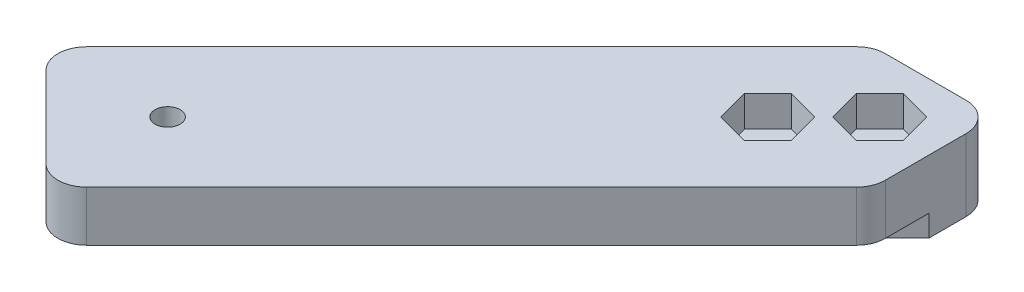
from build123d import *

# Parameters (mm, degrees)
SKETCH1_W           = 74.397474683
SKETCH1_H           = 76.437474683
SKETCH1_R           = 1.75
SKETCH1_R_2         = 2
BOSS_EXTRUDE1_DEPTH = 7
CUT_EXTRUDE1_DEPTH  = 4.3
CUT_EXTRUDE2_DEPTH  = 82.61445454
CUT_EXTRUDE3_DEPTH  = 3.2
BOSS_EXTRUDE2_START = 3
SKETCH5_R           = 2
BOSS_EXTRUDE2_DEPTH = 3
CUT_EXTRUDE4_DEPTH  = 82.926303407
FILLET1_R           = 4


with BuildPart() as part:
    # Sketch1 → Boss-Extrude1 (new body)
    with BuildSketch(Plane(origin=(0, 0, 0), x_dir=(1, 0, 0), z_dir=(0, 1, 0))):
        with Locations((20.298737342, 19.278737341)):
            Rectangle(SKETCH1_W, SKETCH1_H)
        with Locations(Location((0, 0, 0), (0, 0, 270))):
            Circle(SKETCH1_R, mode=Mode.SUBTRACT)
        with Locations(Location((49.497474683, 49.497474683, 0), (0, 0, 270))):
            Circle(SKETCH1_R_2, mode=Mode.SUBTRACT)
        with Locations(Location((41.71930009, 41.71930009, 0), (0, 0, 270))):
            Circle(SKETCH1_R_2, mode=Mode.SUBTRACT)
    extrude(amount=BOSS_EXTRUDE1_DEPTH)

    # Sketch2 → Cut-Extrude1 (cut)
    with BuildSketch(Plane(origin=(0, 7, 0), x_dir=(1, 0, 0), z_dir=(0, 1, 0))):
        Polygon((38.453313766, 38.453313766), (42.914734053, 37.257879803), (46.180720377, 40.523866127), (44.985286414, 44.985286414), (40.523866127, 46.180720377), (37.257879803, 42.914734053), align=None)
        Polygon((50.692908646, 45.036054396), (53.95889497, 48.30204072), (52.763461007, 52.763461007), (48.30204072, 53.95889497), (45.036054396, 50.692908646), (46.231488359, 46.231488359), align=None)
    extrude(amount=-CUT_EXTRUDE1_DEPTH, mode=Mode.SUBTRACT)

    # Sketch3 → Cut-Extrude2 (cut, through all)
    with BuildSketch(Plane(origin=(0, 7, 0), x_dir=(1, 0, 0), z_dir=(0, 1, 0))):
        Polygon((-16.9, 0), (2.04, -18.94), (-16.9, -18.94), align=None)
    extrude(amount=-CUT_EXTRUDE2_DEPTH, mode=Mode.SUBTRACT)

    # Sketch4 → Cut-Extrude3 (cut)
    with BuildSketch(Plane.XZ):
        Polygon((1.732050808, -3), (3.464101615, 0), (1.732050808, 3), (-1.732050808, 3), (-3.464101615, 0), (-1.732050808, -3), align=None)
    extrude(amount=-CUT_EXTRUDE3_DEPTH, mode=Mode.SUBTRACT)

    # Sketch5 → Boss-Extrude2 (add)
    with BuildSketch(Plane.XZ.offset(BOSS_EXTRUDE2_START)):
        Polygon((48.305086528, -57.497474683), (57.497474683, -57.497474683), (57.497474683, -48.305086528), (40.658639918, -31.466251763), (31.466251763, -40.658639918), align=None)
        with Locations(Location((41.71930009, -41.71930009, 0), (0, 0, 270))):
            Circle(SKETCH5_R, mode=Mode.SUBTRACT)
        with Locations(Location((49.497474683, -49.497474683, 0), (0, 0, 270))):
            Circle(SKETCH5_R, mode=Mode.SUBTRACT)
    extrude(amount=-BOSS_EXTRUDE2_DEPTH)

    # Sketch6 → Cut-Extrude4 (cut, through all)
    with BuildSketch(Plane(origin=(0, 7, 0), x_dir=(1, 0, 0), z_dir=(0, 1, 0))):
        Polygon((-16.9, 0), (40.597474683, 57.497474683), (-16.9, 57.497474683), align=None)
        Polygon((57.497474683, 40.597474683), (57.497474683, -18.94), (2.04, -18.94), (0, -16.9), align=None)
    extrude(amount=-CUT_EXTRUDE4_DEPTH, mode=Mode.SUBTRACT)

    # Fillet1
    fillet1_edges = [part.edges().sort_by_distance(p)[0] for p in [
        (0, 3.5, 16.9),
        (57.497474683, 3.5, -40.597474683),
        (40.597474683, 3.5, -57.497474683),
        (-16.9, 3.5, 0),
        (57.497474683, 2, -57.497474683),
    ]]
    fillet(fillet1_edges, radius=FILLET1_R)


solid = part.part
